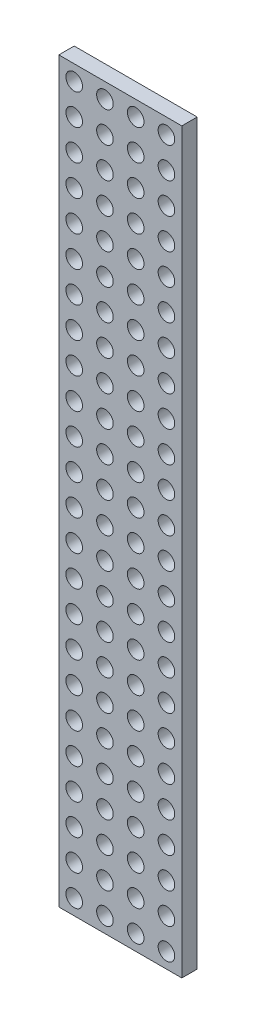
from build123d import *

# Parameters (mm, degrees)
SKETCH1_W           = 50.8
SKETCH1_H           = 304.8
BOSS_EXTRUDE1_DEPTH = 6.35
SKETCH2_R           = 3.429
CUT_EXTRUDE1_DEPTH  = 310.0695755


with BuildPart() as part:
    # Sketch1 → Boss-Extrude1 (new body)
    with BuildSketch(Plane.XY):
        with Locations((25.4, -152.4)):
            Rectangle(SKETCH1_W, SKETCH1_H)
    extrude(amount=BOSS_EXTRUDE1_DEPTH)

    # Sketch2 → Cut-Extrude1 (cut, through all)
    with BuildSketch(Plane.XY):
        with Locations((6.35, -6.35)):
            Circle(SKETCH2_R)
        with Locations((19.05, -6.35)):
            Circle(SKETCH2_R)
        with Locations((31.75, -6.35)):
            Circle(SKETCH2_R)
        with Locations((44.45, -6.35)):
            Circle(SKETCH2_R)
        with Locations((19.05, -19.05)):
            Circle(SKETCH2_R)
        with Locations((31.75, -19.05)):
            Circle(SKETCH2_R)
        with Locations((44.45, -19.05)):
            Circle(SKETCH2_R)
        with Locations((19.05, -31.75)):
            Circle(SKETCH2_R)
        with Locations((31.75, -31.75)):
            Circle(SKETCH2_R)
        with Locations((44.45, -31.75)):
            Circle(SKETCH2_R)
        with Locations((19.05, -44.45)):
            Circle(SKETCH2_R)
        with Locations((31.75, -44.45)):
            Circle(SKETCH2_R)
        with Locations((44.45, -44.45)):
            Circle(SKETCH2_R)
        with Locations((19.05, -57.15)):
            Circle(SKETCH2_R)
        with Locations((31.75, -57.15)):
            Circle(SKETCH2_R)
        with Locations((44.45, -57.15)):
            Circle(SKETCH2_R)
        with Locations((19.05, -69.85)):
            Circle(SKETCH2_R)
        with Locations((31.75, -69.85)):
            Circle(SKETCH2_R)
        with Locations((44.45, -69.85)):
            Circle(SKETCH2_R)
        with Locations((19.05, -82.55)):
            Circle(SKETCH2_R)
        with Locations((31.75, -82.55)):
            Circle(SKETCH2_R)
        with Locations((44.45, -82.55)):
            Circle(SKETCH2_R)
        with Locations((19.05, -95.25)):
            Circle(SKETCH2_R)
        with Locations((31.75, -95.25)):
            Circle(SKETCH2_R)
        with Locations((44.45, -95.25)):
            Circle(SKETCH2_R)
        with Locations((19.05, -107.95)):
            Circle(SKETCH2_R)
        with Locations((31.75, -107.95)):
            Circle(SKETCH2_R)
        with Locations((44.45, -107.95)):
            Circle(SKETCH2_R)
        with Locations((19.05, -120.65)):
            Circle(SKETCH2_R)
        with Locations((31.75, -120.65)):
            Circle(SKETCH2_R)
        with Locations((44.45, -120.65)):
            Circle(SKETCH2_R)
        with Locations((19.05, -133.35)):
            Circle(SKETCH2_R)
        with Locations((31.75, -133.35)):
            Circle(SKETCH2_R)
        with Locations((44.45, -133.35)):
            Circle(SKETCH2_R)
        with Locations((19.05, -146.05)):
            Circle(SKETCH2_R)
        with Locations((31.75, -146.05)):
            Circle(SKETCH2_R)
        with Locations((44.45, -146.05)):
            Circle(SKETCH2_R)
        with Locations((19.05, -158.75)):
            Circle(SKETCH2_R)
        with Locations((31.75, -158.75)):
            Circle(SKETCH2_R)
        with Locations((44.45, -158.75)):
            Circle(SKETCH2_R)
        with Locations((19.05, -171.45)):
            Circle(SKETCH2_R)
        with Locations((31.75, -171.45)):
            Circle(SKETCH2_R)
        with Locations((44.45, -171.45)):
            Circle(SKETCH2_R)
        with Locations((19.05, -184.15)):
            Circle(SKETCH2_R)
        with Locations((31.75, -184.15)):
            Circle(SKETCH2_R)
        with Locations((44.45, -184.15)):
            Circle(SKETCH2_R)
        with Locations((19.05, -196.85)):
            Circle(SKETCH2_R)
        with Locations((31.75, -196.85)):
            Circle(SKETCH2_R)
        with Locations((44.45, -196.85)):
            Circle(SKETCH2_R)
        with Locations((19.05, -209.55)):
            Circle(SKETCH2_R)
        with Locations((31.75, -209.55)):
            Circle(SKETCH2_R)
        with Locations((44.45, -209.55)):
            Circle(SKETCH2_R)
        with Locations((19.05, -222.25)):
            Circle(SKETCH2_R)
        with Locations((31.75, -222.25)):
            Circle(SKETCH2_R)
        with Locations((44.45, -222.25)):
            Circle(SKETCH2_R)
        with Locations((19.05, -234.95)):
            Circle(SKETCH2_R)
        with Locations((31.75, -234.95)):
            Circle(SKETCH2_R)
        with Locations((44.45, -234.95)):
            Circle(SKETCH2_R)
        with Locations((19.05, -247.65)):
            Circle(SKETCH2_R)
        with Locations((31.75, -247.65)):
            Circle(SKETCH2_R)
        with Locations((44.45, -247.65)):
            Circle(SKETCH2_R)
        with Locations((19.05, -260.35)):
            Circle(SKETCH2_R)
        with Locations((31.75, -260.35)):
            Circle(SKETCH2_R)
        with Locations((44.45, -260.35)):
            Circle(SKETCH2_R)
        with Locations((19.05, -273.05)):
            Circle(SKETCH2_R)
        with Locations((31.75, -273.05)):
            Circle(SKETCH2_R)
        with Locations((44.45, -273.05)):
            Circle(SKETCH2_R)
        with Locations((19.05, -285.75)):
            Circle(SKETCH2_R)
        with Locations((31.75, -285.75)):
            Circle(SKETCH2_R)
        with Locations((44.45, -285.75)):
            Circle(SKETCH2_R)
        with Locations((19.05, -298.45)):
            Circle(SKETCH2_R)
        with Locations((31.75, -298.45)):
            Circle(SKETCH2_R)
        with Locations((44.45, -298.45)):
            Circle(SKETCH2_R)
        with Locations((19.05, -311.15)):
            Circle(SKETCH2_R)
        with Locations((31.75, -311.15)):
            Circle(SKETCH2_R)
        with Locations((44.45, -311.15)):
            Circle(SKETCH2_R)
        with Locations((19.05, -323.85)):
            Circle(SKETCH2_R)
        with Locations((31.75, -323.85)):
            Circle(SKETCH2_R)
        with Locations((44.45, -323.85)):
            Circle(SKETCH2_R)
        with Locations((19.05, -336.55)):
            Circle(SKETCH2_R)
        with Locations((31.75, -336.55)):
            Circle(SKETCH2_R)
        with Locations((44.45, -336.55)):
            Circle(SKETCH2_R)
        with Locations((19.05, -349.25)):
            Circle(SKETCH2_R)
        with Locations((31.75, -349.25)):
            Circle(SKETCH2_R)
        with Locations((44.45, -349.25)):
            Circle(SKETCH2_R)
        with Locations((19.05, -361.95)):
            Circle(SKETCH2_R)
        with Locations((31.75, -361.95)):
            Circle(SKETCH2_R)
        with Locations((44.45, -361.95)):
            Circle(SKETCH2_R)
        with Locations((19.05, -374.65)):
            Circle(SKETCH2_R)
        with Locations((31.75, -374.65)):
            Circle(SKETCH2_R)
        with Locations((44.45, -374.65)):
            Circle(SKETCH2_R)
        with Locations((6.35, -19.05)):
            Circle(SKETCH2_R)
        with Locations((6.35, -31.75)):
            Circle(SKETCH2_R)
        with Locations((6.35, -44.45)):
            Circle(SKETCH2_R)
        with Locations((6.35, -57.15)):
            Circle(SKETCH2_R)
        with Locations((6.35, -69.85)):
            Circle(SKETCH2_R)
        with Locations((6.35, -82.55)):
            Circle(SKETCH2_R)
        with Locations((6.35, -95.25)):
            Circle(SKETCH2_R)
        with Locations((6.35, -107.95)):
            Circle(SKETCH2_R)
        with Locations((6.35, -120.65)):
            Circle(SKETCH2_R)
        with Locations((6.35, -133.35)):
            Circle(SKETCH2_R)
        with Locations((6.35, -146.05)):
            Circle(SKETCH2_R)
        with Locations((6.35, -158.75)):
            Circle(SKETCH2_R)
        with Locations((6.35, -171.45)):
            Circle(SKETCH2_R)
        with Locations((6.35, -184.15)):
            Circle(SKETCH2_R)
        with Locations((6.35, -196.85)):
            Circle(SKETCH2_R)
        with Locations((6.35, -209.55)):
            Circle(SKETCH2_R)
        with Locations((6.35, -222.25)):
            Circle(SKETCH2_R)
        with Locations((6.35, -234.95)):
            Circle(SKETCH2_R)
        with Locations((6.35, -247.65)):
            Circle(SKETCH2_R)
        with Locations((6.35, -260.35)):
            Circle(SKETCH2_R)
        with Locations((6.35, -273.05)):
            Circle(SKETCH2_R)
        with Locations((6.35, -285.75)):
            Circle(SKETCH2_R)
        with Locations((6.35, -298.45)):
            Circle(SKETCH2_R)
        with Locations((6.35, -311.15)):
            Circle(SKETCH2_R)
        with Locations((6.35, -323.85)):
            Circle(SKETCH2_R)
        with Locations((6.35, -336.55)):
            Circle(SKETCH2_R)
        with Locations((6.35, -349.25)):
            Circle(SKETCH2_R)
        with Locations((6.35, -361.95)):
            Circle(SKETCH2_R)
        with Locations((6.35, -374.65)):
            Circle(SKETCH2_R)
    extrude(amount=CUT_EXTRUDE1_DEPTH, mode=Mode.SUBTRACT)


solid = part.part
